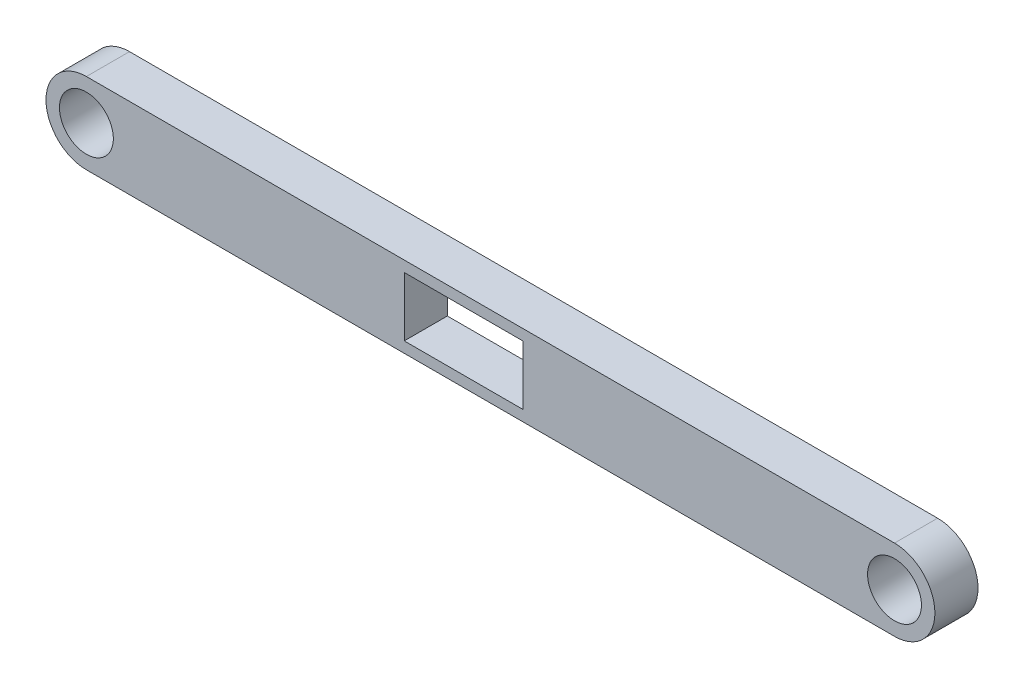
from build123d import *

# Parameters (mm, degrees)
SKETCH1_R           = 5
SKETCH1_W           = 22
SKETCH1_H           = 11
BOSS_EXTRUDE1_DEPTH = 8


with BuildPart() as part:
    # Sketch1 → Boss-Extrude1 (new body)
    with BuildSketch(Plane.XY):
        with BuildLine():
            Line((75, -7.5), (-75, -7.5))
            ThreePointArc((-75, -7.5), (-82.5, 0), (-75, 7.5))
            Line((-75, 7.5), (75, 7.5))
            ThreePointArc((75, 7.5), (82.5, 0), (75, -7.5))
        make_face()
        with Locations((75, 0)):
            Circle(SKETCH1_R, mode=Mode.SUBTRACT)
        with Locations(Location((-75, 0, 0), (0, 0, 180))):
            Circle(SKETCH1_R, mode=Mode.SUBTRACT)
        with Locations((-5, 0)):
            Rectangle(SKETCH1_W, SKETCH1_H, mode=Mode.SUBTRACT)
    extrude(amount=BOSS_EXTRUDE1_DEPTH)


solid = part.part
